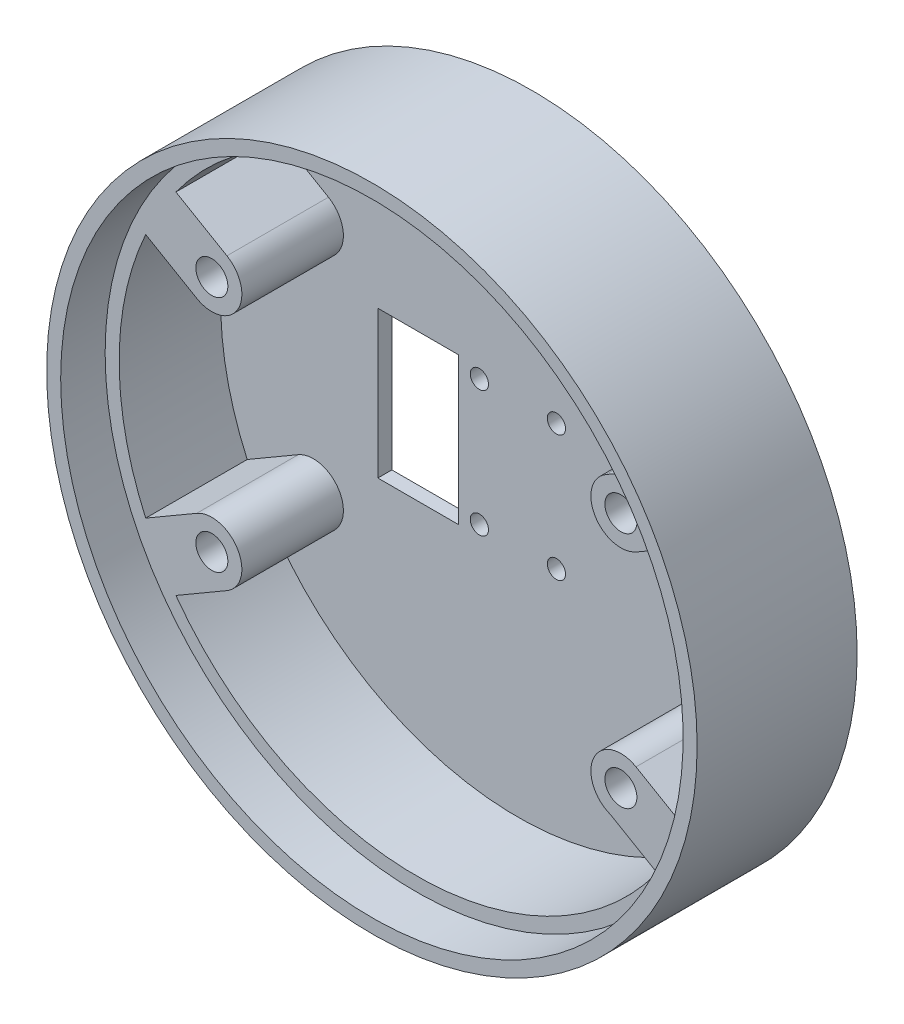
from build123d import *

# Parameters (mm, degrees)
BOSS_EXTRUDE5_DEPTH         = 22.85
BOSS_EXTRUDE5_DEPTH_BACK    = 0.00254
SKETCH1_R                   = 46.45
SKETCH1_12_R                = 44.45
CUT_EXTRUDE13_DEPTH         = 70.550898628
F_3_16_0_1875_DOWEL_HOLE1_D = 4.7625
F_3_16_0_1875_DOWEL_HOLE3_D = 4.7625
F_3_16_0_1875_DOWEL_HOLE4_D = 4.7625
F_3_16_0_1875_DOWEL_HOLE5_D = 4.7625
SKETCH1_21_R                = 44.45
SKETCH1_21_R_2              = 42.45
BOSS_EXTRUDE16_DEPTH        = 16.5
BOSS_EXTRUDE15_DEPTH        = 16.5
CUT_EXTRUDE21_DEPTH         = 70.550898628
CUT_EXTRUDE21_DEPTH_BACK    = 4
SKETCH24_4_R                = 2.286
SKETCH25_R                  = 42.45
BOSS_EXTRUDE17_DEPTH        = 2
CUT_EXTRUDE22_DEPTH         = 70.550898628
CUT_EXTRUDE22_DEPTH_BACK    = 70.550898628
SKETCH21_W                  = 11.5
SKETCH21_H                  = 21
SKETCH21_R                  = 1.3
SKETCH21_R_2                = 1.3000014
SKETCH26_R                  = 2.38125
CUT_EXTRUDE23_DEPTH         = 3


with BuildPart() as part:
    # Sketch1 → Boss-Extrude5 (new, two sides: drawn at the far end of the back side and taken through both)
    with BuildSketch(Plane.XY.offset(-BOSS_EXTRUDE5_DEPTH_BACK)):
        Circle(SKETCH1_R)
    extrude(amount=BOSS_EXTRUDE5_DEPTH + BOSS_EXTRUDE5_DEPTH_BACK)

    # Sketch1<12> → Cut-Extrude13 (cut, through all)
    with BuildSketch(Plane.XY):
        Circle(SKETCH1_12_R)
    extrude(amount=CUT_EXTRUDE13_DEPTH, mode=Mode.SUBTRACT)

    # 3/16 (0.1875) Dowel Hole1 (through all)
    with Locations(Plane.XY):
        with Locations((-29.21, 17.000000036)):
            Hole(F_3_16_0_1875_DOWEL_HOLE1_D / 2)

    # 3/16 (0.1875) Dowel Hole3 (through all)
    with Locations(Plane.XY):
        with Locations((-29.21, -16.999999964)):
            Hole(F_3_16_0_1875_DOWEL_HOLE3_D / 2)

    # 3/16 (0.1875) Dowel Hole4 (through all)
    with Locations(Plane.XY):
        with Locations((29.21, -16.999999964)):
            Hole(F_3_16_0_1875_DOWEL_HOLE4_D / 2)

    # 3/16 (0.1875) Dowel Hole5 (through all)
    with Locations(Plane.XY):
        with Locations((29.21, 17.000000036)):
            Hole(F_3_16_0_1875_DOWEL_HOLE5_D / 2)

    # Sketch1<21> → Boss-Extrude16 (add)
    with BuildSketch(Plane.XY):
        Circle(SKETCH1_21_R)
        Circle(SKETCH1_21_R_2, mode=Mode.SUBTRACT)
    extrude(amount=BOSS_EXTRUDE16_DEPTH)

    # Sketch24 → Boss-Extrude15 (add)
    with BuildSketch(Plane.XY):
        with BuildLine():
            Line((40.581072285, 18.64087695), (36.261488643, 26.062938004))
            Line((36.261488643, 26.062938004), (27.054115803, 20.704316346))
            ThreePointArc((27.054115803, 20.704316346), (25.50568369, 14.844115839), (31.365884197, 13.295683726))
            Line((31.365884197, 13.295683726), (31.373699445, 13.282255292))
            Line((31.373699445, 13.282255292), (40.581072285, 18.64087695))
        make_face()
        with BuildLine():
            Line((27.725141272, -21.020570888), (36.293779908, -26.007454028))
            Line((36.293779908, -26.007454028), (40.573257072, -18.654305309))
            Line((40.573257072, -18.654305309), (31.365884191, -13.29568365))
            ThreePointArc((31.365884191, -13.29568365), (25.333011542, -15.172773516), (27.725141272, -21.020570888))
        make_face()
        with BuildLine():
            Line((-36.261488643, 26.062938004), (-40.573257038, 18.654305383))
            Line((-40.573257038, 18.654305383), (-31.365884197, 13.295683726))
            ThreePointArc((-31.365884197, 13.295683726), (-25.50568369, 14.844115839), (-27.054115803, 20.704316346))
            Line((-27.054115803, 20.704316346), (-36.261488643, 26.062938004))
        make_face()
        with BuildLine():
            Line((-31.365884191, -13.29568365), (-40.573257072, -18.654305309))
            Line((-40.573257072, -18.654305309), (-36.261488691, -26.062937937))
            Line((-36.261488691, -26.062937937), (-27.054115809, -20.704316278))
            ThreePointArc((-27.054115809, -20.704316278), (-25.505683686, -14.844115773), (-31.365884191, -13.29568365))
        make_face()
    extrude(amount=BOSS_EXTRUDE15_DEPTH)

    # Sketch24<4> → Cut-Extrude21 (cut, two sides: drawn at the far end of the back side and taken through both)
    with BuildSketch(Plane.XY.offset(-CUT_EXTRUDE21_DEPTH_BACK)):
        with Locations((29.21, 17.000000036)):
            Circle(SKETCH24_4_R)
        with Locations((29.21, -16.999999964)):
            Circle(SKETCH24_4_R)
        with Locations((-29.21, 17.000000036)):
            Circle(SKETCH24_4_R)
        with Locations((-29.21, -16.999999964)):
            Circle(SKETCH24_4_R)
    extrude(amount=CUT_EXTRUDE21_DEPTH + CUT_EXTRUDE21_DEPTH_BACK, mode=Mode.SUBTRACT)

    # Sketch25 → Boss-Extrude17 (add)
    with BuildSketch(Plane.XY):
        Circle(SKETCH25_R)
    extrude(amount=BOSS_EXTRUDE17_DEPTH)

    # Sketch21 → Cut-Extrude22 (cut, two sides: drawn at the far end of the back side and taken through both)
    with BuildSketch(Plane.XY.offset(-CUT_EXTRUDE22_DEPTH_BACK)):
        with Locations((-14.25, 0)):
            Rectangle(SKETCH21_W, SKETCH21_H)
        with Locations((-5.5, 9)):
            Circle(SKETCH21_R)
        with Locations((5.5, 9)):
            Circle(SKETCH21_R)
        with Locations((5.5, -9)):
            Circle(SKETCH21_R)
        with Locations((-5.5, -9)):
            Circle(SKETCH21_R_2)
    extrude(amount=CUT_EXTRUDE22_DEPTH + CUT_EXTRUDE22_DEPTH_BACK, mode=Mode.SUBTRACT)

    # Sketch26 → Cut-Extrude23 (cut)
    with BuildSketch(Plane(origin=(0, 0, -0.00254), x_dir=(-1, 0, 0), z_dir=(0, 0, -1))):
        with Locations((29.21, -16.999999964)):
            Circle(SKETCH26_R)
        with Locations((29.21, 17.000000036)):
            Circle(SKETCH26_R)
        with Locations((-29.21, 17.000000036)):
            Circle(SKETCH26_R)
        with Locations((-29.21, -16.999999964)):
            Circle(SKETCH26_R)
    extrude(amount=-CUT_EXTRUDE23_DEPTH, mode=Mode.SUBTRACT)


solid = part.part
